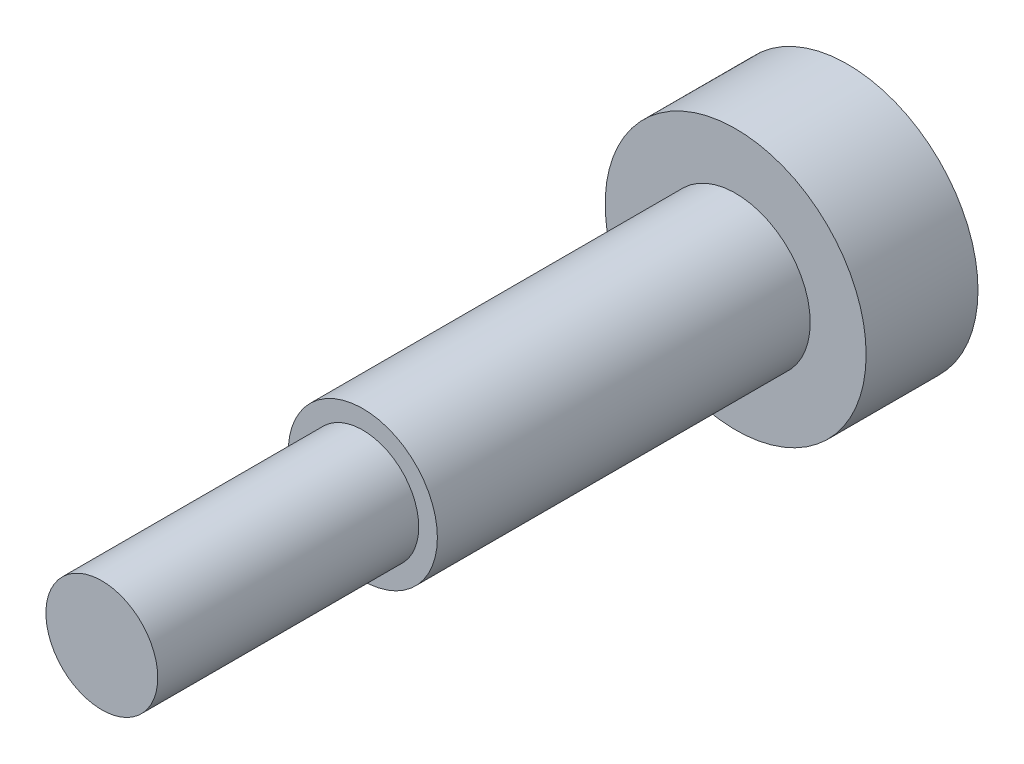
from build123d import *

# Parameters (mm, degrees)
F_01_START                             = -3
S01_SOCKET_HEAD_R                      = 3.5
F_01_SOCKET_HEAD_DEPTH                 = 3
S02_GROUND_SHOULDER_R                  = 2
F_02_GROUND_SHOULDER_DEPTH             = 10
F_03_START                             = 10
S03_THREADED_TIP_MAJOR_DIAMETER_R      = 1.5
F_03_THREADED_TIP_MAJOR_DIAMETER_DEPTH = 7
F_04_START                             = -3.1
F_04_HEXAGONAL_DRIVE_DEPTH             = 2.14


with BuildPart() as part:
    # S01 - Socket head → 01 - Socket head (new body)
    with BuildSketch(Plane.XY.offset(F_01_START)):
        Circle(S01_SOCKET_HEAD_R)
    extrude(amount=F_01_SOCKET_HEAD_DEPTH)

    # S02 - Ground shoulder → 02 - Ground shoulder (add)
    with BuildSketch(Plane.XY):
        Circle(S02_GROUND_SHOULDER_R)
    extrude(amount=F_02_GROUND_SHOULDER_DEPTH)

    # S03 - Threaded tip major diameter → 03 - Threaded tip major diameter (add)
    with BuildSketch(Plane.XY.offset(F_03_START)):
        Circle(S03_THREADED_TIP_MAJOR_DIAMETER_R)
    extrude(amount=F_03_THREADED_TIP_MAJOR_DIAMETER_DEPTH)

    # S04 - Hexagonal drive → 04 - Hexagonal drive (cut)
    with BuildSketch(Plane.XY.offset(F_04_START)):
        Polygon((1.154700538, 0), (0.577350269, 1), (-0.577350269, 1), (-1.154700538, 0), (-0.577350269, -1), (0.577350269, -1), align=None)
    extrude(amount=F_04_HEXAGONAL_DRIVE_DEPTH, mode=Mode.SUBTRACT)


solid = part.part
